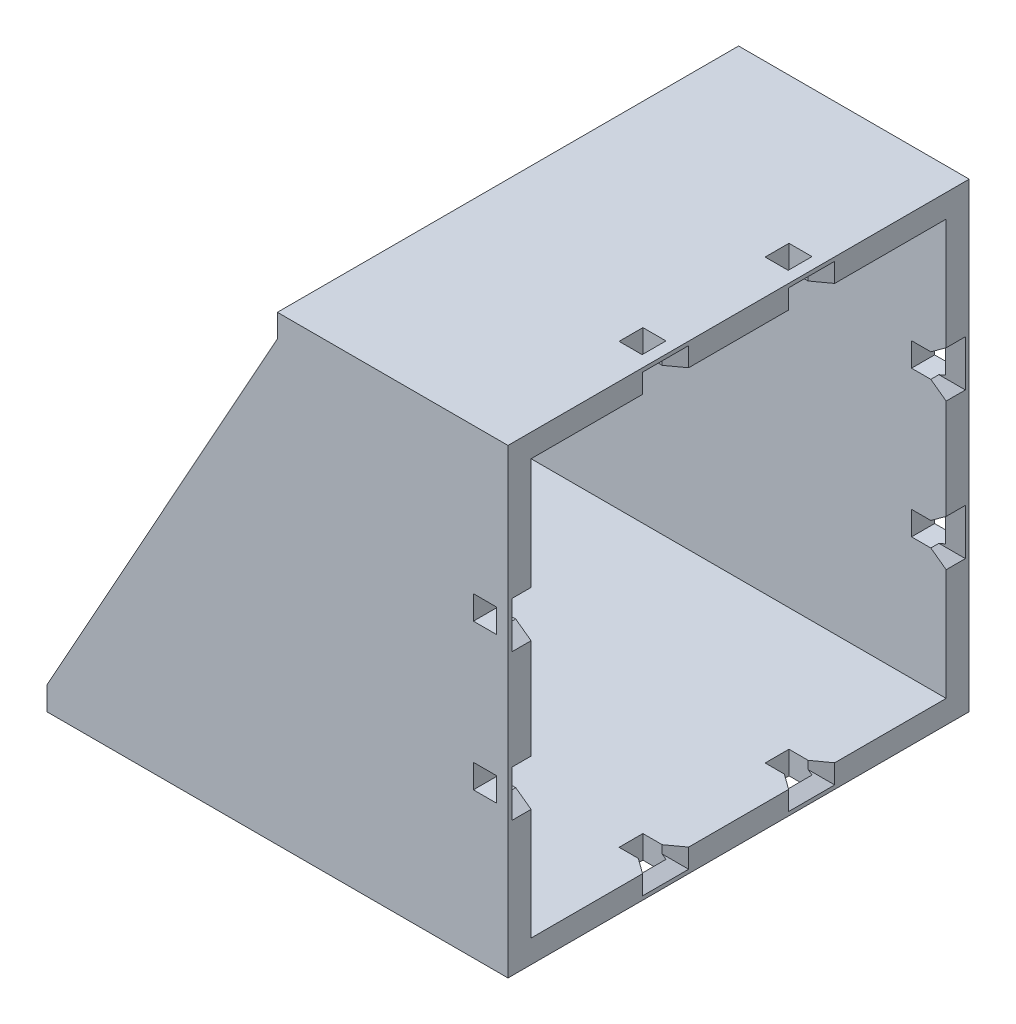
from build123d import *

# Parameters (mm, degrees)
SKETCH_1_W                    = 60
SKETCH_1_H                    = 60
EXTRUDE_1_DEPTH               = 3
SKETCH_2_W                    = 30
SKETCH_2_H                    = 60
EXTRUDE_2_DEPTH               = 3
EXTRUDE_3_DEPTH               = 3
EXTRUDE_4_DEPTH               = 3
SKETCH_8_W                    = 3
SKETCH_8_H                    = 3.1
CUT_EXTRUDE_2_DEPTH           = 91.000000167
SKETCH_9_W                    = 3
SKETCH_9_H                    = 3.1
CUT_EXTRUDE_3_DEPTH           = 74.484692447
SKETCH_7_W                    = 6
SKETCH_7_H                    = 5
CUT_EXTRUDE_1_DEPTH           = 2
CUT_EXTRUDE_1_DRAFT           = -36
SKETCH_7_W_2                  = 5
SKETCH_7_H_2                  = 6
CUT_EXTRUDE_1_PROFILE_2_DEPTH = 2
CUT_EXTRUDE_1_PROFILE_2_DRAFT = -36
CUT_EXTRUDE_1_PROFILE_3_DEPTH = 2
CUT_EXTRUDE_1_PROFILE_3_DRAFT = -36
CUT_EXTRUDE_1_PROFILE_4_DEPTH = 2
CUT_EXTRUDE_1_PROFILE_4_DRAFT = -36
CUT_EXTRUDE_1_PROFILE_5_DEPTH = 2
CUT_EXTRUDE_1_PROFILE_5_DRAFT = -36
CUT_EXTRUDE_1_PROFILE_6_DEPTH = 2
CUT_EXTRUDE_1_PROFILE_6_DRAFT = -36
CUT_EXTRUDE_1_PROFILE_7_DEPTH = 2
CUT_EXTRUDE_1_PROFILE_7_DRAFT = -36
CUT_EXTRUDE_1_PROFILE_8_DEPTH = 2
CUT_EXTRUDE_1_PROFILE_8_DRAFT = -36


with BuildPart() as part:
    # 草图1 → 凸台-拉伸1 (new body)
    with BuildSketch(Plane(origin=(0, 0, 0), x_dir=(1, 0, 0), z_dir=(0, 1, 0))):
        Rectangle(SKETCH_1_W, SKETCH_1_H)
    extrude(amount=EXTRUDE_1_DEPTH)



with BuildPart() as body_2:
    # 草图2 → 凸台-拉伸2 (new body)
    with BuildSketch(Plane(origin=(0, 57, 0), x_dir=(1, 0, 0), z_dir=(0, 1, 0))):
        with Locations((15, 0)):
            Rectangle(SKETCH_2_W, SKETCH_2_H)
    extrude(amount=EXTRUDE_2_DEPTH)


with BuildPart() as part_1:
    add(part.part)

    add(body_2.part)  # 放样1 merges body 2
    # 草图3 → 放样1 section 0
    with BuildSketch(Plane.XZ.offset(-57)):
        with BuildLine():
            Line((0, 30), (3, 30))
            Line((3, 30), (3, -30))
            Line((3, -30), (0, -30))
            Line((0, -30), (0, 30))
        make_face()
    # 草图4 → 放样1 section 1
    with BuildSketch(Plane(origin=(0, 3, 0), x_dir=(1, 0, 0), z_dir=(0, 1, 0))):
        with BuildLine():
            Line((-30, 30), (-27, 30))
            Line((-27, 30), (-27, -30))
            Line((-27, -30), (-30, -30))
            Line((-30, -30), (-30, 30))
        make_face()
    loft()

    # 草图5 → 凸台-拉伸3 (add)
    with BuildSketch(Plane.XY.offset(30)):
        Polygon((30, 57), (3, 57), (-27, 3), (30, 3), align=None)
    extrude(amount=-EXTRUDE_3_DEPTH)

    # 草图6 → 凸台-拉伸4 (add)
    with BuildSketch(Plane(origin=(0, 0, -30), x_dir=(-1, 0, 0), z_dir=(0, 0, -1))):
        Polygon((-30, 57), (-3, 57), (27, 3), (-30, 3), align=None)
    extrude(amount=-EXTRUDE_4_DEPTH)

    # 草图8 → 切除-拉伸2 (cut, through all)
    with BuildSketch(Plane(origin=(0, 0, -30), x_dir=(-1, 0, 0), z_dir=(0, 0, -1))):
        with Locations((-27, 39.5)):
            Rectangle(SKETCH_8_W, SKETCH_8_H)
        with Locations((-27, 20.5)):
            Rectangle(SKETCH_8_W, SKETCH_8_H)
    extrude(amount=-CUT_EXTRUDE_2_DEPTH, mode=Mode.SUBTRACT)

    # 草图9 → 切除-拉伸3 (cut, through all)
    with BuildSketch(Plane(origin=(0, 60, 0), x_dir=(1, 0, 0), z_dir=(0, 1, 0))):
        with Locations((27, 9.5)):
            Rectangle(SKETCH_9_W, SKETCH_9_H)
        with Locations((27, -9.5)):
            Rectangle(SKETCH_9_W, SKETCH_9_H)
    extrude(amount=-CUT_EXTRUDE_3_DEPTH, mode=Mode.SUBTRACT)


with BuildPart() as cut_extrude_1_tool:
    # 草图7 → 切除-拉伸1 (with draft: the straight prism first)
    with BuildSketch(Plane(origin=(30, 0, 0), x_dir=(0, 0, -1), z_dir=(1, 0, 0))):
        with Locations((9.5, 3)):
            Rectangle(SKETCH_7_W, SKETCH_7_H)
    extrude(amount=-CUT_EXTRUDE_1_DEPTH)
    # 切除-拉伸1: the draft: its side faces are tilted about the plane it starts from
    cut_extrude_1_sides = [cut_extrude_1_tool.faces().sort_by_distance(p)[0] for p in [
        (29, 3, -6.5),
        (29, 0.5, -9.5),
        (29, 3, -12.5),
        (29, 5.5, -9.5),
    ]]
    draft(cut_extrude_1_sides, Plane(origin=(30, 0, 0), x_dir=(0, 0, -1), z_dir=(1, 0, 0)), CUT_EXTRUDE_1_DRAFT)


with BuildPart() as part_2:
    add(part_1.part)

    # 切除-拉伸1: cut by cut_extrude_1_tool
    add(cut_extrude_1_tool.part, mode=Mode.SUBTRACT)


with BuildPart() as cut_extrude_1_profile_2_tool:
    # 草图7 → 切除-拉伸1 profile 2 (with draft: the straight prism first)
    with BuildSketch(Plane(origin=(30, 0, 0), x_dir=(0, 0, -1), z_dir=(1, 0, 0))):
        with Locations((27, 39.5)):
            Rectangle(SKETCH_7_W_2, SKETCH_7_H_2)
    extrude(amount=-CUT_EXTRUDE_1_PROFILE_2_DEPTH)
    # 切除-拉伸1 profile 2: the draft: its side faces are tilted about the plane it starts from
    cut_extrude_1_profile_2_sides = [cut_extrude_1_profile_2_tool.faces().sort_by_distance(p)[0] for p in [
        (29, 36.5, -27),
        (29, 39.5, -29.5),
        (29, 42.5, -27),
        (29, 39.5, -24.5),
    ]]
    draft(cut_extrude_1_profile_2_sides, Plane(origin=(30, 0, 0), x_dir=(0, 0, -1), z_dir=(1, 0, 0)), CUT_EXTRUDE_1_PROFILE_2_DRAFT)


with BuildPart() as part_3:
    add(part_2.part)

    # 切除-拉伸1 profile 2: cut by cut_extrude_1_profile_2_tool
    add(cut_extrude_1_profile_2_tool.part, mode=Mode.SUBTRACT)


with BuildPart() as cut_extrude_1_profile_3_tool:
    # 草图7 → 切除-拉伸1 profile 3 (with draft: the straight prism first)
    with BuildSketch(Plane(origin=(30, 0, 0), x_dir=(0, 0, -1), z_dir=(1, 0, 0))):
        with Locations((27, 20.5)):
            Rectangle(SKETCH_7_W_2, SKETCH_7_H_2)
    extrude(amount=-CUT_EXTRUDE_1_PROFILE_3_DEPTH)
    # 切除-拉伸1 profile 3: the draft: its side faces are tilted about the plane it starts from
    cut_extrude_1_profile_3_sides = [cut_extrude_1_profile_3_tool.faces().sort_by_distance(p)[0] for p in [
        (29, 23.5, -27),
        (29, 20.5, -24.5),
        (29, 17.5, -27),
        (29, 20.5, -29.5),
    ]]
    draft(cut_extrude_1_profile_3_sides, Plane(origin=(30, 0, 0), x_dir=(0, 0, -1), z_dir=(1, 0, 0)), CUT_EXTRUDE_1_PROFILE_3_DRAFT)


with BuildPart() as part_4:
    add(part_3.part)

    # 切除-拉伸1 profile 3: cut by cut_extrude_1_profile_3_tool
    add(cut_extrude_1_profile_3_tool.part, mode=Mode.SUBTRACT)


with BuildPart() as cut_extrude_1_profile_4_tool:
    # 草图7 → 切除-拉伸1 profile 4 (with draft: the straight prism first)
    with BuildSketch(Plane(origin=(30, 0, 0), x_dir=(0, 0, -1), z_dir=(1, 0, 0))):
        with Locations((-9.5, 3)):
            Rectangle(SKETCH_7_W, SKETCH_7_H)
    extrude(amount=-CUT_EXTRUDE_1_PROFILE_4_DEPTH)
    # 切除-拉伸1 profile 4: the draft: its side faces are tilted about the plane it starts from
    cut_extrude_1_profile_4_sides = [cut_extrude_1_profile_4_tool.faces().sort_by_distance(p)[0] for p in [
        (29, 3, 6.5),
        (29, 5.5, 9.5),
        (29, 3, 12.5),
        (29, 0.5, 9.5),
    ]]
    draft(cut_extrude_1_profile_4_sides, Plane(origin=(30, 0, 0), x_dir=(0, 0, -1), z_dir=(1, 0, 0)), CUT_EXTRUDE_1_PROFILE_4_DRAFT)


with BuildPart() as part_5:
    add(part_4.part)

    # 切除-拉伸1 profile 4: cut by cut_extrude_1_profile_4_tool
    add(cut_extrude_1_profile_4_tool.part, mode=Mode.SUBTRACT)


with BuildPart() as cut_extrude_1_profile_5_tool:
    # 草图7 → 切除-拉伸1 profile 5 (with draft: the straight prism first)
    with BuildSketch(Plane(origin=(30, 0, 0), x_dir=(0, 0, -1), z_dir=(1, 0, 0))):
        with Locations((-27, 20.5)):
            Rectangle(SKETCH_7_W_2, SKETCH_7_H_2)
    extrude(amount=-CUT_EXTRUDE_1_PROFILE_5_DEPTH)
    # 切除-拉伸1 profile 5: the draft: its side faces are tilted about the plane it starts from
    cut_extrude_1_profile_5_sides = [cut_extrude_1_profile_5_tool.faces().sort_by_distance(p)[0] for p in [
        (29, 23.5, 27),
        (29, 20.5, 29.5),
        (29, 17.5, 27),
        (29, 20.5, 24.5),
    ]]
    draft(cut_extrude_1_profile_5_sides, Plane(origin=(30, 0, 0), x_dir=(0, 0, -1), z_dir=(1, 0, 0)), CUT_EXTRUDE_1_PROFILE_5_DRAFT)


with BuildPart() as part_6:
    add(part_5.part)

    # 切除-拉伸1 profile 5: cut by cut_extrude_1_profile_5_tool
    add(cut_extrude_1_profile_5_tool.part, mode=Mode.SUBTRACT)


with BuildPart() as cut_extrude_1_profile_6_tool:
    # 草图7 → 切除-拉伸1 profile 6 (with draft: the straight prism first)
    with BuildSketch(Plane(origin=(30, 0, 0), x_dir=(0, 0, -1), z_dir=(1, 0, 0))):
        with Locations((-27, 39.5)):
            Rectangle(SKETCH_7_W_2, SKETCH_7_H_2)
    extrude(amount=-CUT_EXTRUDE_1_PROFILE_6_DEPTH)
    # 切除-拉伸1 profile 6: the draft: its side faces are tilted about the plane it starts from
    cut_extrude_1_profile_6_sides = [cut_extrude_1_profile_6_tool.faces().sort_by_distance(p)[0] for p in [
        (29, 36.5, 27),
        (29, 39.5, 24.5),
        (29, 42.5, 27),
        (29, 39.5, 29.5),
    ]]
    draft(cut_extrude_1_profile_6_sides, Plane(origin=(30, 0, 0), x_dir=(0, 0, -1), z_dir=(1, 0, 0)), CUT_EXTRUDE_1_PROFILE_6_DRAFT)


with BuildPart() as part_7:
    add(part_6.part)

    # 切除-拉伸1 profile 6: cut by cut_extrude_1_profile_6_tool
    add(cut_extrude_1_profile_6_tool.part, mode=Mode.SUBTRACT)


with BuildPart() as cut_extrude_1_profile_7_tool:
    # 草图7 → 切除-拉伸1 profile 7 (with draft: the straight prism first)
    with BuildSketch(Plane(origin=(30, 0, 0), x_dir=(0, 0, -1), z_dir=(1, 0, 0))):
        with Locations((-9.5, 57)):
            Rectangle(SKETCH_7_W, SKETCH_7_H)
    extrude(amount=-CUT_EXTRUDE_1_PROFILE_7_DEPTH)
    # 切除-拉伸1 profile 7: the draft: its side faces are tilted about the plane it starts from
    cut_extrude_1_profile_7_sides = [cut_extrude_1_profile_7_tool.faces().sort_by_distance(p)[0] for p in [
        (29, 57, 6.5),
        (29, 59.5, 9.5),
        (29, 57, 12.5),
        (29, 54.5, 9.5),
    ]]
    draft(cut_extrude_1_profile_7_sides, Plane(origin=(30, 0, 0), x_dir=(0, 0, -1), z_dir=(1, 0, 0)), CUT_EXTRUDE_1_PROFILE_7_DRAFT)


with BuildPart() as part_8:
    add(part_7.part)

    # 切除-拉伸1 profile 7: cut by cut_extrude_1_profile_7_tool
    add(cut_extrude_1_profile_7_tool.part, mode=Mode.SUBTRACT)


with BuildPart() as cut_extrude_1_profile_8_tool:
    # 草图7 → 切除-拉伸1 profile 8 (with draft: the straight prism first)
    with BuildSketch(Plane(origin=(30, 0, 0), x_dir=(0, 0, -1), z_dir=(1, 0, 0))):
        with Locations((9.5, 57)):
            Rectangle(SKETCH_7_W, SKETCH_7_H)
    extrude(amount=-CUT_EXTRUDE_1_PROFILE_8_DEPTH)
    # 切除-拉伸1 profile 8: the draft: its side faces are tilted about the plane it starts from
    cut_extrude_1_profile_8_sides = [cut_extrude_1_profile_8_tool.faces().sort_by_distance(p)[0] for p in [
        (29, 57, -6.5),
        (29, 54.5, -9.5),
        (29, 57, -12.5),
        (29, 59.5, -9.5),
    ]]
    draft(cut_extrude_1_profile_8_sides, Plane(origin=(30, 0, 0), x_dir=(0, 0, -1), z_dir=(1, 0, 0)), CUT_EXTRUDE_1_PROFILE_8_DRAFT)


with BuildPart() as part_9:
    add(part_8.part)

    # 切除-拉伸1 profile 8: cut by cut_extrude_1_profile_8_tool
    add(cut_extrude_1_profile_8_tool.part, mode=Mode.SUBTRACT)


solid = part_9.part
